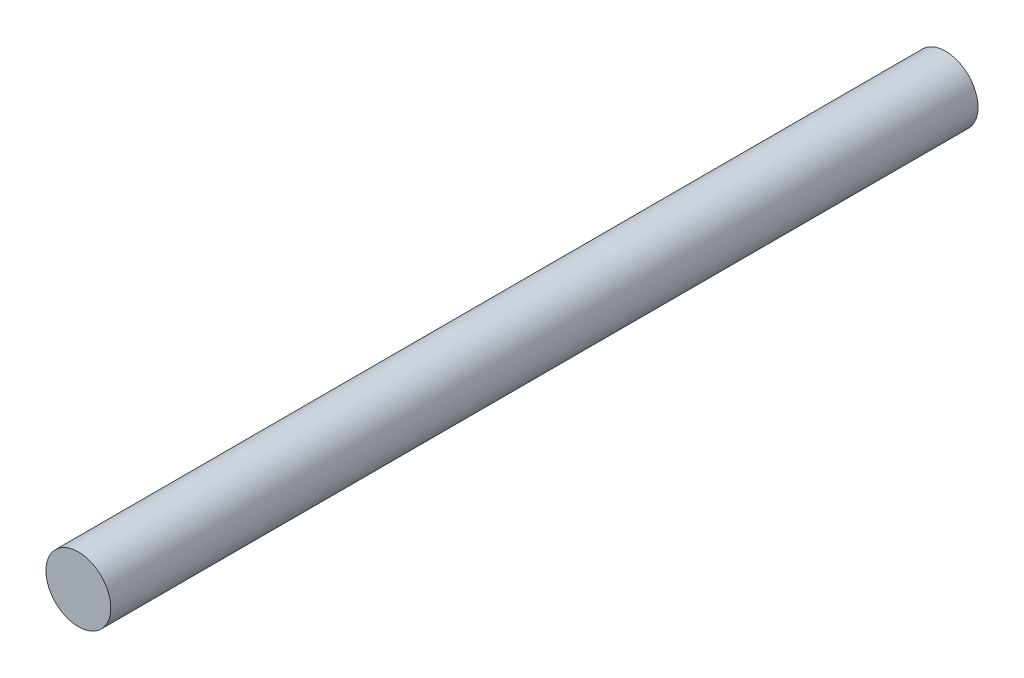
from build123d import *

# Parameters (mm, degrees)
SKETCH1_R           = 4
BOSS_EXTRUDE1_DEPTH = 107


with BuildPart() as part:
    # Sketch1 → Boss-Extrude1 (new body)
    with BuildSketch(Plane.XY):
        Circle(SKETCH1_R)
    extrude(amount=BOSS_EXTRUDE1_DEPTH)


solid = part.part
